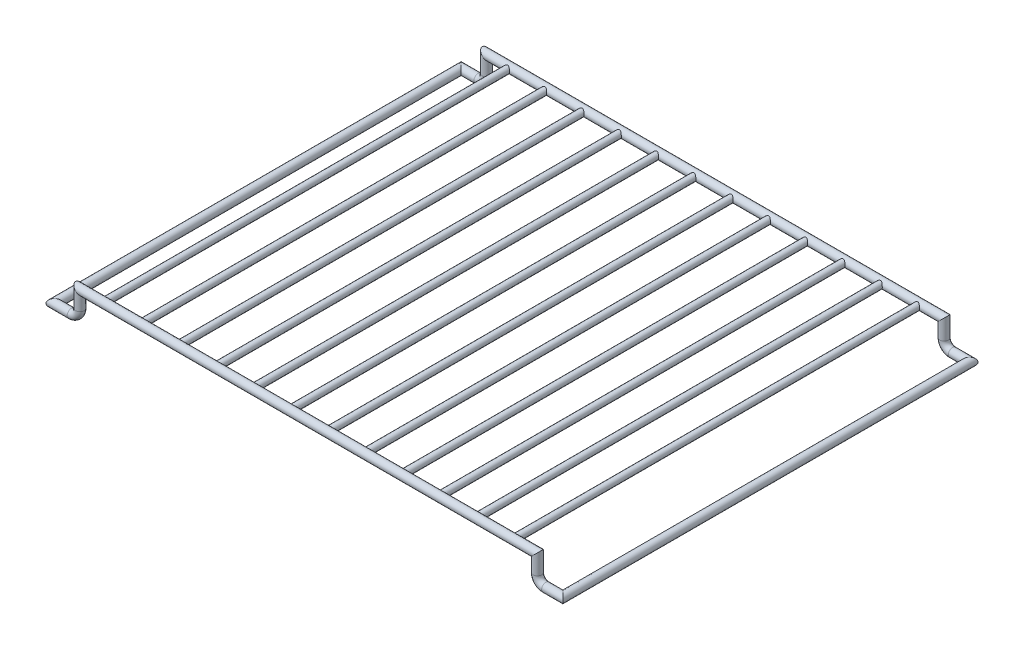
from build123d import *

# Parameters (mm, degrees)
SKETCH_1_R             = 2.5
EXTRUDE_2_REACH        = 289
EXTRUDE_2_END_RADIUS   = 2.5
SKETCH_2_R             = 2
PATTERN_LINEAR_1_COUNT = 6
PATTERN_LINEAR_1_PITCH = 22


with BuildPart() as part:
    # 扫描1: sweep along a curve in space
    with BuildLine() as sweep_1_path:
        Line((0, 0, 0), (135, 0, 0))
        Line((135, 0, 0), (135, -10, 0))
        ThreePointArc((135, -10, 0), (136.464466094, -13.535533906, 0), (140, -15, 0))
        Line((140, -15, 0), (150, -15, 0))
        Line((150, -15, 0), (150, -15, 240))
        Line((150, -15, 240), (140, -15, 240))
        ThreePointArc((140, -15, 240), (136.464466094, -13.535533906, 240), (135, -10, 240))
        Line((135, -10, 240), (135, 0, 240))
        Line((135, 0, 240), (0, 0, 240))
    # 草图1 → 扫描1 (sweep)
    with BuildSketch(Plane(origin=(0, 0, 0), x_dir=(0, 0, -1), z_dir=(1, 0, 0))):
        Circle(SKETCH_1_R)
    sweep(path=sweep_1_path.line, transition=Transition.RIGHT)

    # 凸台-拉伸2: up to this cylinder (the profile starts outside it)
    extrude_2_end = Plane(origin=(11, 0, 240), z_dir=(-1, 0, 0)) * Cylinder(EXTRUDE_2_END_RADIUS, 584, mode=Mode.PRIVATE)
    # 草图2 → 凸台-拉伸2 (add, up to the surface)
    with BuildSketch(Plane.XY, mode=Mode.PRIVATE) as extrude_2_sk1:
        with Locations(Location((11, 0, 0), (0, 0, 180))):
            Circle(SKETCH_2_R)
    extrude_2_tool1 = extrude(extrude_2_sk1.sketch, amount=EXTRUDE_2_REACH, mode=Mode.PRIVATE) - extrude_2_end
    extrude_2 = extrude_2_tool1.solids().sort_by_distance((11, 0, 0))[0]
    add(extrude_2)

    # 阵列(线性)1: 凸台-拉伸2 ×6
    with Locations(*[(i * PATTERN_LINEAR_1_PITCH, 0, 0) for i in range(1, PATTERN_LINEAR_1_COUNT)]):
        add(extrude_2)

    # 镜向1: part across plane


with BuildPart() as part_1:
    add(part.part)
    add(part.part.mirror(Plane(origin=(0, 0, 0), x_dir=(0, 0, 1), z_dir=(1, 0, 0))))


solid = part_1.part
